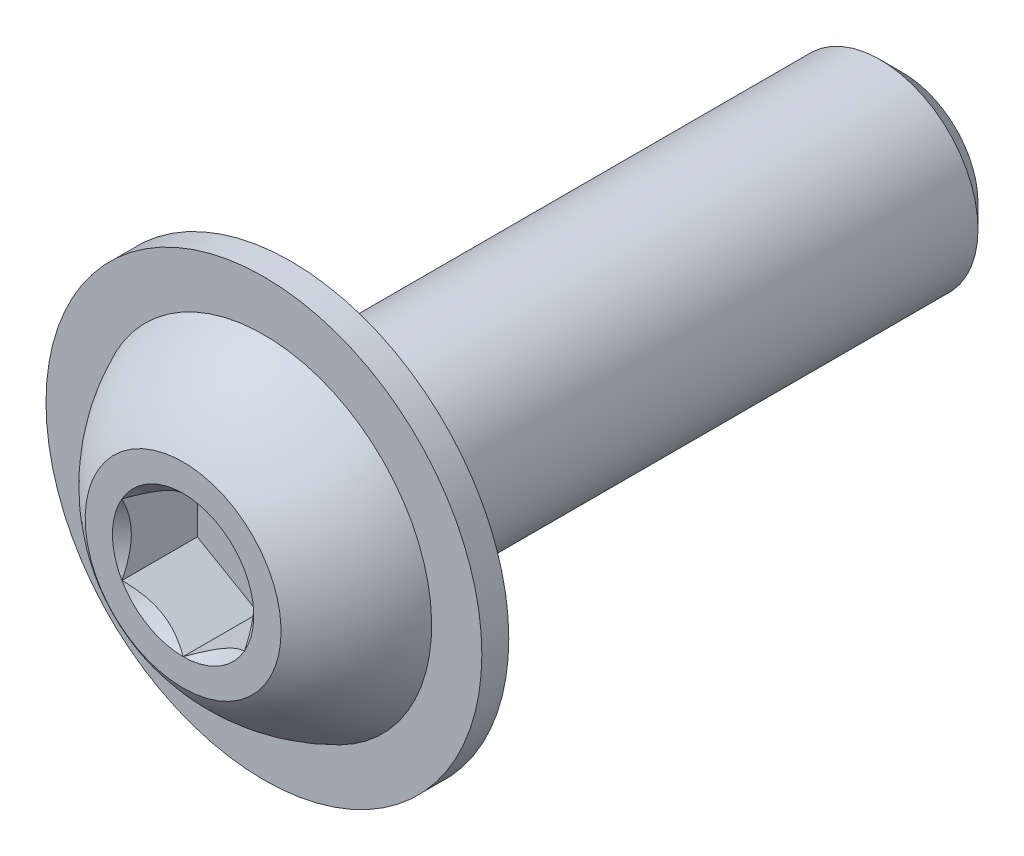
from build123d import *

# Parameters (mm, degrees)
SKETCH13_W         = 25
SKETCH13_H         = 4
CHAMFER1_SIZE      = 0.9375
CUT_EXTRUDE2_DEPTH = 3.08


with BuildPart() as part:
    # Sketch13 → Revolve1 (revolve)
    with BuildSketch(Plane(origin=(0, 0, 0), x_dir=(0, 0, -1), z_dir=(1, 0, 0))):
        with Locations((2.2, 2)):
            Rectangle(SKETCH13_W, SKETCH13_H)
    revolve(axis=Axis((0, 0, 14.7), (0, 0, -1)))

    # Chamfer1
    chamfer1_edges = [part.edges().sort_by_distance(p)[0] for p in [
        (0, -4, -14.7),
    ]]
    chamfer(chamfer1_edges, length=CHAMFER1_SIZE)

    # Sketch7 → Revolve2 (revolve)
    with BuildSketch(Plane(origin=(0, 0, 0), x_dir=(0, 0, -1), z_dir=(1, 0, 0))):
        with BuildLine():
            Line((-10.3, 6.85), (-10.3, 0))
            Line((-10.3, 0), (-14.7, 0))
            Line((-14.7, 0), (-14.7, 4))
            ThreePointArc((-14.7, 4), (-13.261912668, 5.670372563), (-11.4, 6.85))
            Line((-11.4, 6.85), (-11.4, 8.9))
            Line((-11.4, 8.9), (-10.3, 8.9))
            Line((-10.3, 8.9), (-10.3, 6.85))
        make_face()
    revolve(axis=Axis((0, 0, 14.7), (0, 0, -1)))

    # Sketch5 → Cut-Extrude2 (cut)
    with BuildSketch(Plane.XY.offset(14.7)):
        Polygon((2.5, -1.443375673), (2.5, 1.443375673), (0, 2.886751346), (-2.5, 1.443375673), (-2.5, -1.443375673), (0, -2.886751346), align=None)
    extrude(amount=-CUT_EXTRUDE2_DEPTH, mode=Mode.SUBTRACT)

    # Cut-Extrude3 cone 1 section (through the dimple's axis) → Cut-Extrude3 (revolve, cut)
    with BuildSketch(Plane(origin=(0, 0, 14.7), x_dir=(0, -1, 0), z_dir=(1, 0, 0))):
        Polygon((0, 0), (2.886751346, 0), (0, 2.886751346), align=None)
    revolve(axis=Axis((0, 0, 14.7), (0, 0, -1)), mode=Mode.SUBTRACT)


solid = part.part
